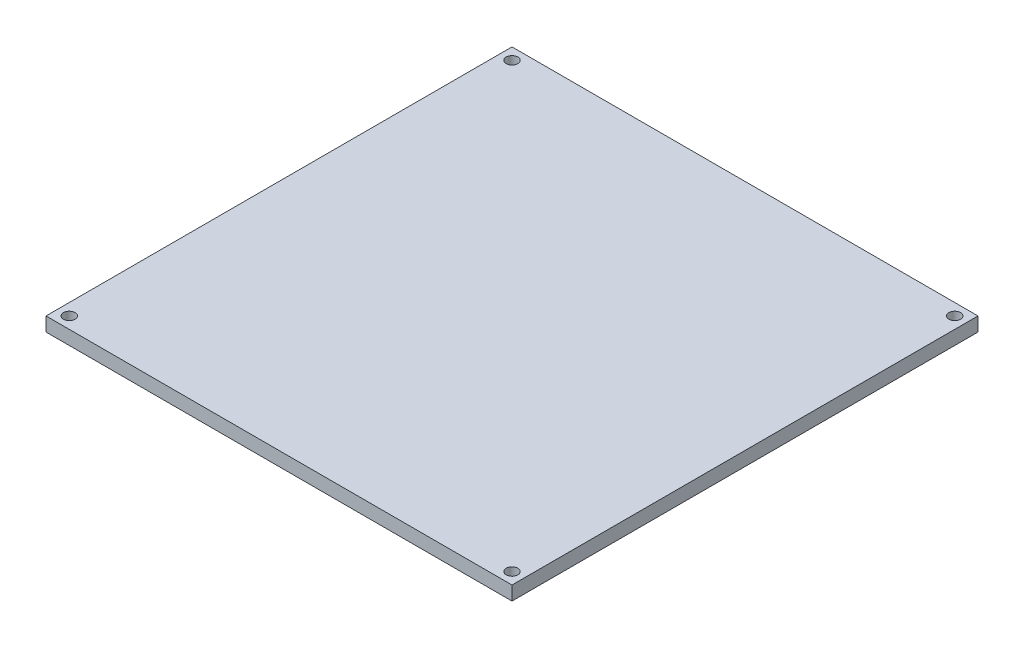
from build123d import *

# Parameters (mm, degrees)
SKETCH2_W           = 100
SKETCH2_H           = 100
SKETCH2_R           = 1.25
BOSS_EXTRUDE1_DEPTH = 3


with BuildPart() as part:
    # Sketch2 → Boss-Extrude1 (new body)
    with BuildSketch(Plane(origin=(0, 0, 0), x_dir=(1, 0, 0), z_dir=(0, 1, 0))):
        with Locations((50, 50)):
            Rectangle(SKETCH2_W, SKETCH2_H)
        with Locations(Location((2.5, 97.5, 0), (0, 0, 270))):
            Circle(SKETCH2_R, mode=Mode.SUBTRACT)
        with Locations(Location((2.5, 2.5, 0), (0, 0, 270))):
            Circle(SKETCH2_R, mode=Mode.SUBTRACT)
        with Locations(Location((97.5, 97.5, 0), (0, 0, 270))):
            Circle(SKETCH2_R, mode=Mode.SUBTRACT)
        with Locations(Location((97.5, 2.5, 0), (0, 0, 270))):
            Circle(SKETCH2_R, mode=Mode.SUBTRACT)
    extrude(amount=BOSS_EXTRUDE1_DEPTH)


solid = part.part
